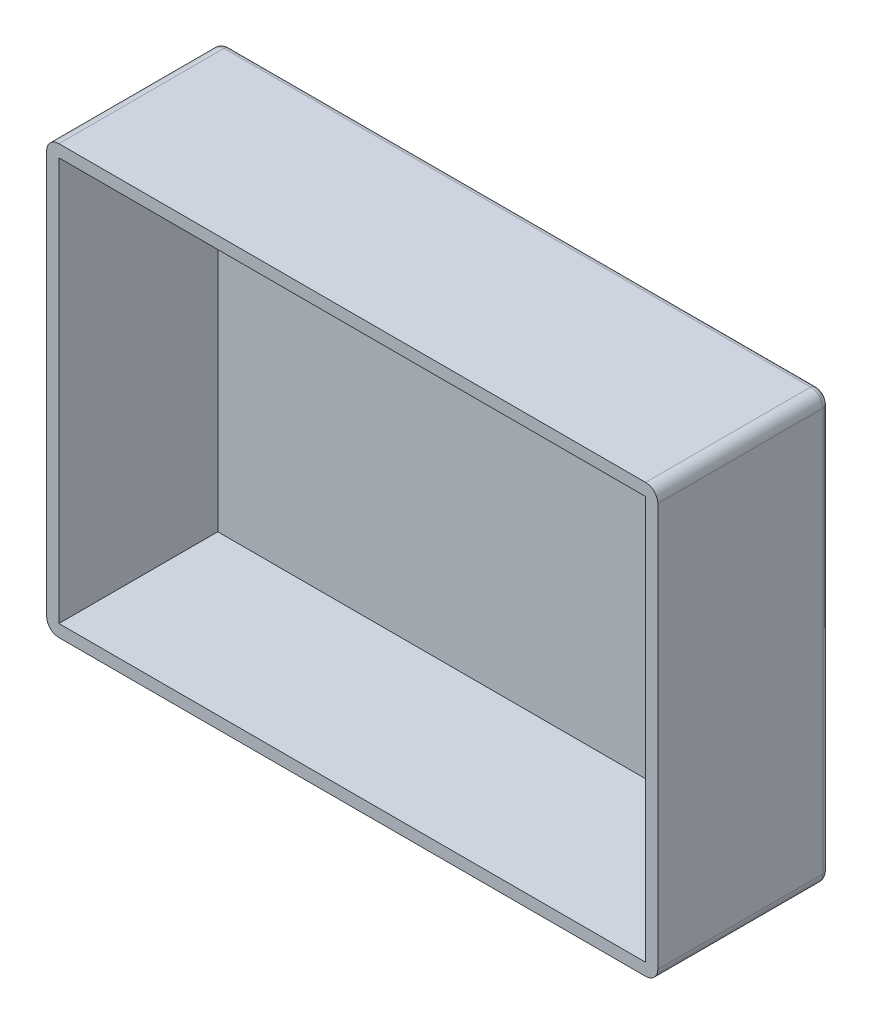
from build123d import *

# Parameters (mm, degrees)
SKETCH1_W           = 500
SKETCH1_H           = 350
BOSS_EXTRUDE2_DEPTH = 140
SKETCH4_W           = 480
SKETCH4_H           = 330
CUT_EXTRUDE3_DEPTH  = 130
FILLET1_R           = 10
FILLET3_R           = 5


with BuildPart() as part:
    # Sketch1 → Boss-Extrude2 (new body)
    with BuildSketch(Plane.XY):
        Rectangle(SKETCH1_W, SKETCH1_H)
    extrude(amount=BOSS_EXTRUDE2_DEPTH)

    # Sketch4 → Cut-Extrude3 (cut)
    with BuildSketch(Plane.XY.offset(140)):
        Rectangle(SKETCH4_W, SKETCH4_H)
    extrude(amount=-CUT_EXTRUDE3_DEPTH, mode=Mode.SUBTRACT)

    # Fillet1
    fillet1_edges = [part.edges().sort_by_distance(p)[0] for p in [
        (250, -175, 70),
        (-250, -175, 70),
        (-250, 175, 70),
        (250, 175, 70),
    ]]
    fillet(fillet1_edges, radius=FILLET1_R)

    # Fillet3
    fillet3_edges = [part.edges().sort_by_distance(p)[0] for p in [
        (0, 175, 0),
        (250, 0, 0),
        (0, -175, 0),
        (-250, 0, 0),
        (-247.071067812, -172.071067812, 0),
        (-247.071067812, 172.071067812, 0),
        (247.071067812, -172.071067812, 0),
        (247.071067812, 172.071067812, 0),
    ]]
    fillet(fillet3_edges, radius=FILLET3_R)


solid = part.part
